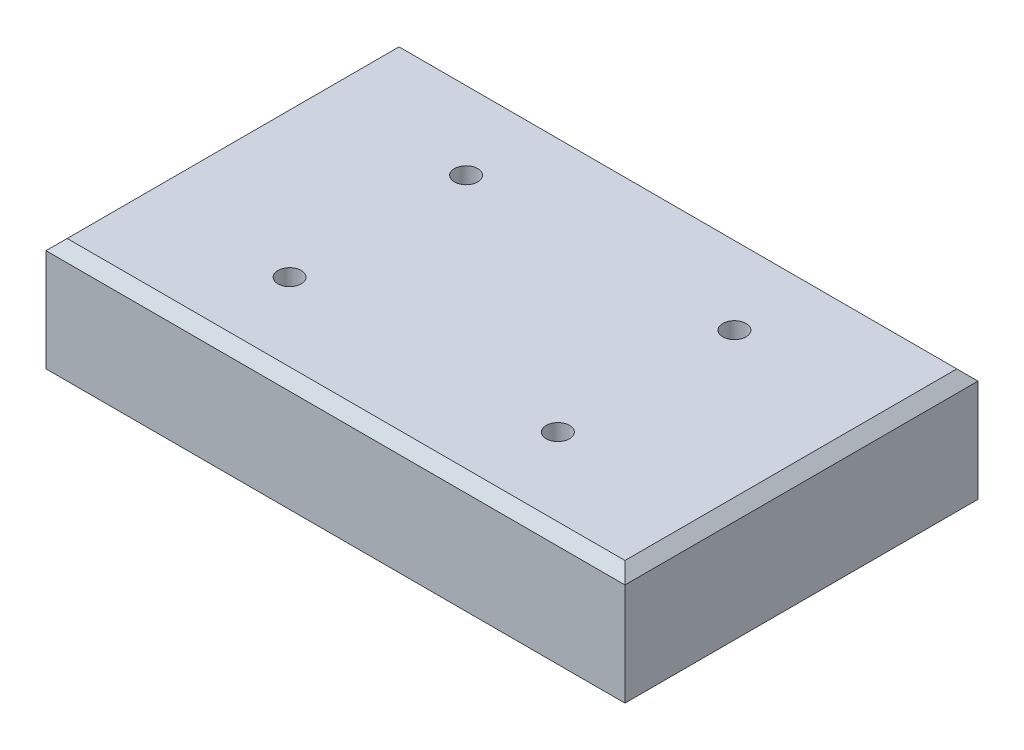
from build123d import *

# Parameters (mm, degrees)
SKETCH1_W             = 82
SKETCH1_H             = 50
BOSS_EXTRUDE2_DEPTH   = 16
CHAMFER1_SIZE         = 1.5
M4_TAPPED_HOLE1_D     = 3.3
M4_TAPPED_HOLE1_DEPTH = 8
M4_TAPPED_HOLE1_TIP   = 0.991420021


with BuildPart() as part:
    # Sketch1 → Boss-Extrude2 (new body)
    with BuildSketch(Plane(origin=(0, 0, 0), x_dir=(1, 0, 0), z_dir=(0, 1, 0))):
        Rectangle(SKETCH1_W, SKETCH1_H)
    extrude(amount=BOSS_EXTRUDE2_DEPTH)

    # Chamfer1
    chamfer1_edges = [part.edges().sort_by_distance(p)[0] for p in [
        (41, 16, 0),
        (0, 16, -25),
        (-41, 16, 0),
        (0, 16, 25),
    ]]
    chamfer(chamfer1_edges, length=CHAMFER1_SIZE)

    # M4 Tapped Hole1
    with Locations(Plane(origin=(0, 16, 0), x_dir=(1, 0, 0), z_dir=(0, 1, 0))):
        with Locations((-19, 12.5), (19, 12.5), (19, -12.5), (-19, -12.5)):
            Hole(M4_TAPPED_HOLE1_D / 2, depth=M4_TAPPED_HOLE1_DEPTH)
            with Locations((0, 0, -(M4_TAPPED_HOLE1_DEPTH + M4_TAPPED_HOLE1_TIP / 2))):  # 118° drill point
                Cone(0, M4_TAPPED_HOLE1_D / 2, M4_TAPPED_HOLE1_TIP, mode=Mode.SUBTRACT)


solid = part.part
